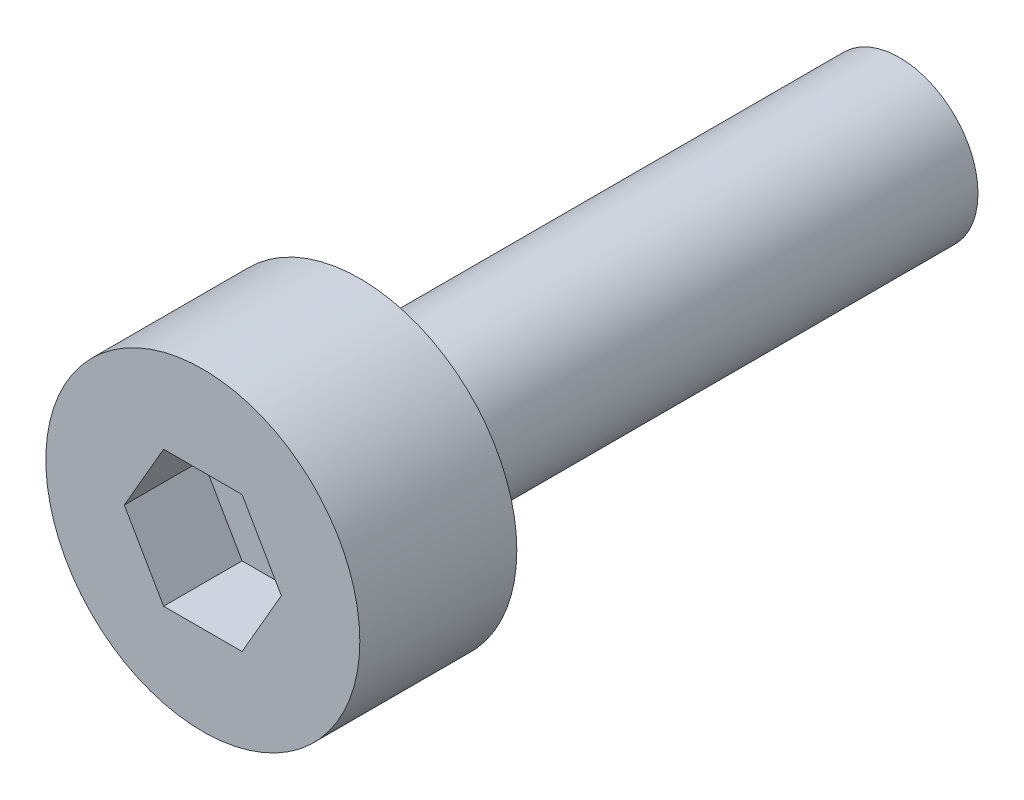
from build123d import *

# Parameters (mm, degrees)
SKETCH_1_R          = 1.6
EXTRUDE_1_DEPTH     = 1.6
SKETCH_3_R          = 0.8
EXTRUDE_3_DEPTH     = 5.5
CUT_EXTRUDE_1_DEPTH = 0.8


with BuildPart() as part:
    # 草图1 → 凸台-拉伸1 (new body)
    with BuildSketch(Plane.XY):
        Circle(SKETCH_1_R)
    extrude(amount=EXTRUDE_1_DEPTH)

    # 草图3 → 凸台-拉伸3 (add)
    with BuildSketch(Plane.XY):
        Circle(SKETCH_3_R)
    extrude(amount=-EXTRUDE_3_DEPTH)

    # 草图4 → 切除-拉伸1 (cut)
    with BuildSketch(Plane.XY.offset(1.6)):
        Polygon((0.8, 0), (0.4, 0.692820323), (-0.4, 0.692820323), (-0.8, 0), (-0.4, -0.692820323), (0.4, -0.692820323), align=None)
    extrude(amount=-CUT_EXTRUDE_1_DEPTH, mode=Mode.SUBTRACT)


solid = part.part
